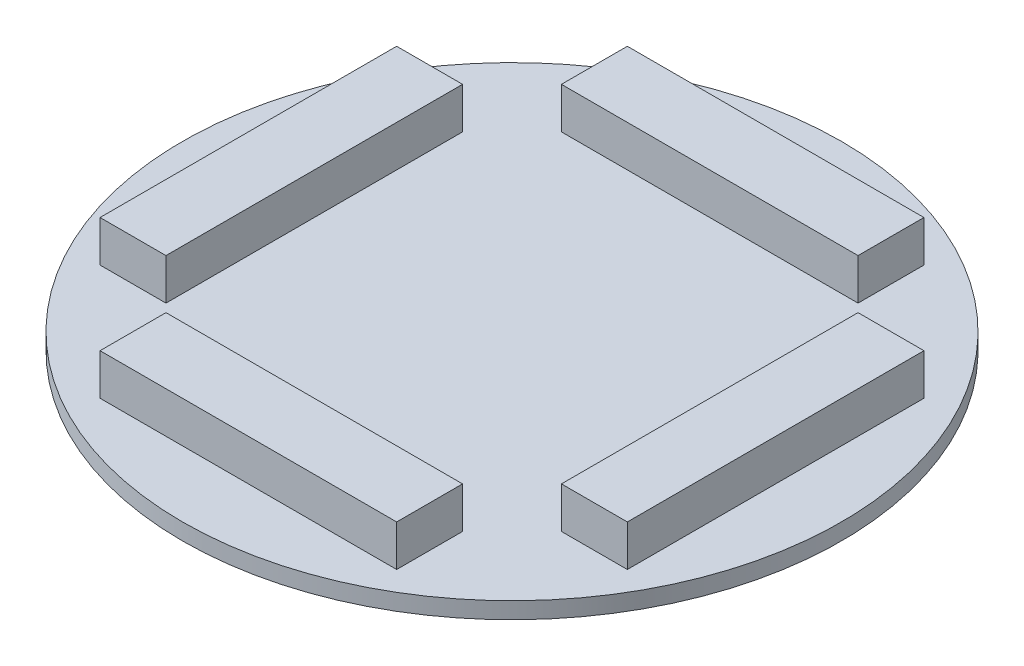
from build123d import *

# Parameters (mm, degrees)
SKETCH1_R                    = 20
PCB_DEPTH                    = 1
SKETCH2_W                    = 18
SKETCH2_H                    = 4
HIROSE_CONNECTOR_STACK_DEPTH = 2.5
CIRPATTERN1_COUNT            = 4


with BuildPart() as part:
    # Sketch1 → PCB (new body)
    with BuildSketch(Plane(origin=(0, 0, 0), x_dir=(1, 0, 0), z_dir=(0, 1, 0))):
        with Locations(Location((0, 0, 0), (0, 0, 270))):
            Circle(SKETCH1_R)
    extrude(amount=PCB_DEPTH)

    # Sketch2 → Hirose Connector Stack (add)
    with BuildSketch(Plane(origin=(0, 1, 0), x_dir=(1, 0, 0), z_dir=(0, 1, 0))):
        with Locations((0, 14)):
            Rectangle(SKETCH2_W, SKETCH2_H)
    hirose_connector_stack = extrude(amount=HIROSE_CONNECTOR_STACK_DEPTH)

    # CirPattern1: Hirose Connector Stack ×4 about axis
    cirpattern1_axis = Axis((0, 0, 0), (0, 1, 0))
    for i in range(1, CIRPATTERN1_COUNT):
        add(hirose_connector_stack.rotate(cirpattern1_axis, i * 360 / CIRPATTERN1_COUNT))


solid = part.part
